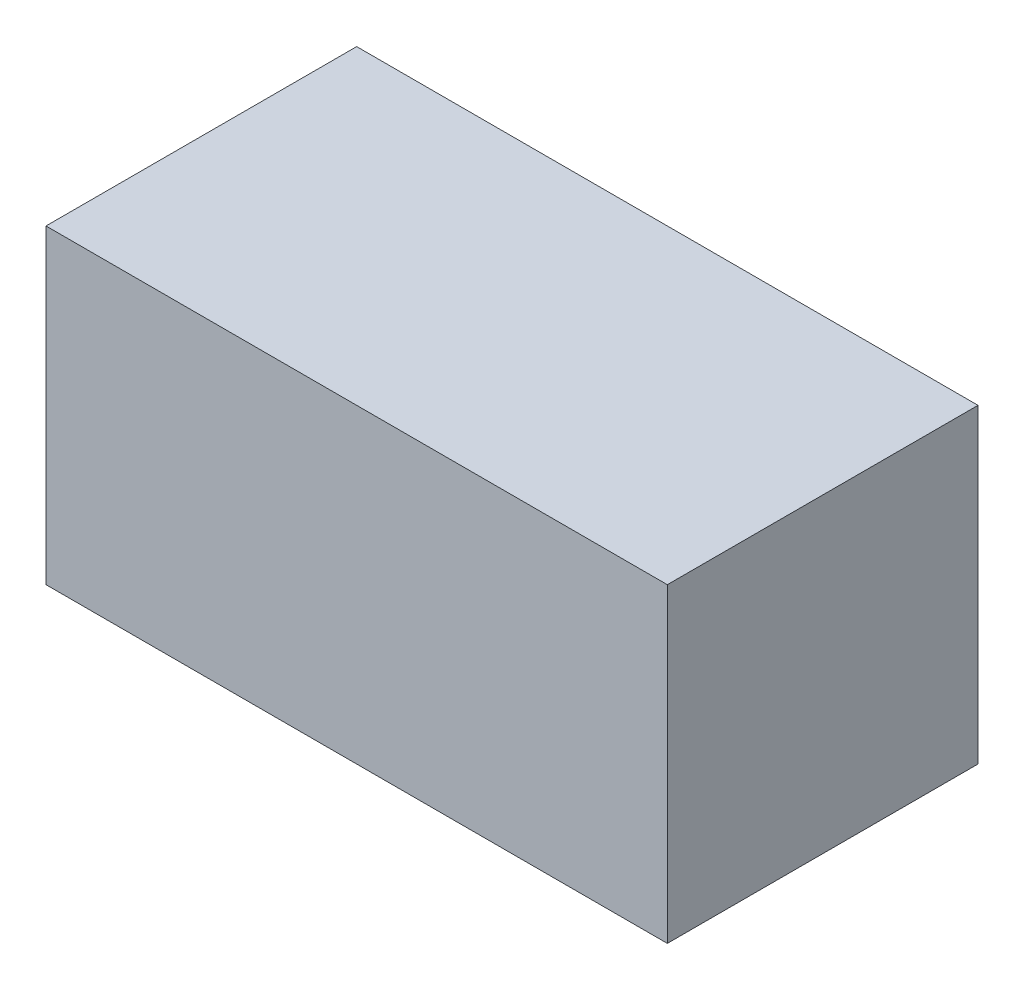
from build123d import *

# Parameters (mm, degrees)
SKETCH1_W           = 0.4
SKETCH1_H           = 0.2
BOSS_EXTRUDE1_DEPTH = 0.2


with BuildPart() as part:
    # Sketch1 → Boss-Extrude1 (new body)
    with BuildSketch(Plane(origin=(0, 0, 0), x_dir=(1, 0, 0), z_dir=(0, 1, 0))):
        with Locations((0.2, 0.1)):
            Rectangle(SKETCH1_W, SKETCH1_H)
    extrude(amount=BOSS_EXTRUDE1_DEPTH)


solid = part.part
